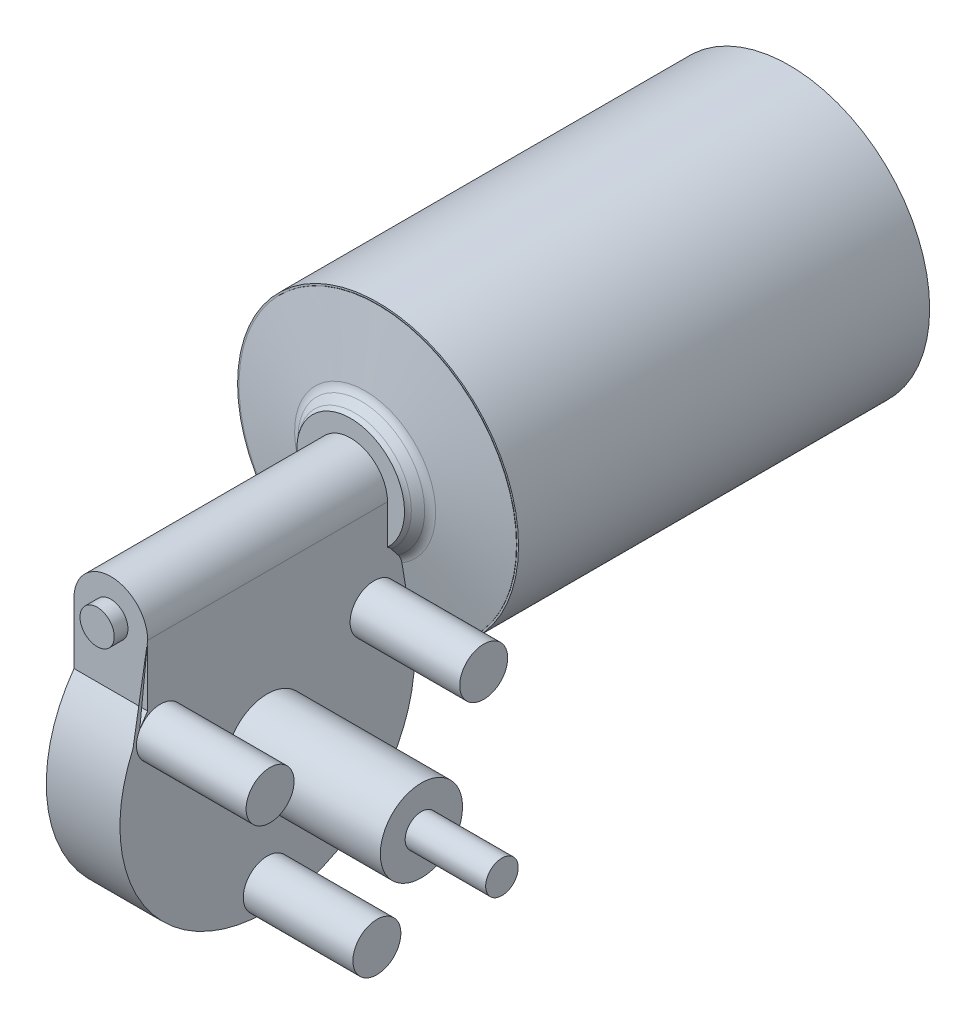
from build123d import *

# Parameters (mm, degrees)
SKETCH1_R           = 41
BOSS_EXTRUDE1_DEPTH = 62
SKETCH2_R           = 41
BOSS_EXTRUDE2_DEPTH = 4
SKETCH3_R           = 41
SKETCH3_R_2         = 40.5
CUT_EXTRUDE1_DEPTH  = 8
SKETCH5_R           = 10.75
BOSS_EXTRUDE3_DEPTH = 70
SKETCH6_R           = 5
BOSS_EXTRUDE4_DEPTH = 4
BOSS_EXTRUDE5_DEPTH = 10.75
SKETCH8_R           = 7
BOSS_EXTRUDE6_DEPTH = 32
SKETCH9_R           = 12
BOSS_EXTRUDE7_DEPTH = 45
SKETCH10_R          = 4.75
BOSS_EXTRUDE8_DEPTH = 23.5


with BuildPart() as part:
    # Sketch1 → Boss-Extrude1 (new, symmetric)
    with BuildSketch(Plane.XY):
        Circle(SKETCH1_R)
    extrude(amount=BOSS_EXTRUDE1_DEPTH, both=True)

    # Sketch2 → Boss-Extrude2 (add, symmetric)
    with BuildSketch(Plane.XY.offset(62)):
        Circle(SKETCH2_R)
    extrude(amount=BOSS_EXTRUDE2_DEPTH, both=True)

    # Sketch3 → Cut-Extrude1 (cut)
    with BuildSketch(Plane.XY.offset(66)):
        Circle(SKETCH3_R)
        Circle(SKETCH3_R_2, mode=Mode.SUBTRACT)
    extrude(amount=-CUT_EXTRUDE1_DEPTH, mode=Mode.SUBTRACT)

    # Sketch4 → Cut-Revolve1 (revolve, cut)
    with BuildSketch(Plane(origin=(0, 0, 0), x_dir=(0, 0, -1), z_dir=(1, 0, 0)), mode=Mode.PRIVATE) as cut_revolve1_sk:
        with BuildLine():
            Line((-58, 41), (-61.774006584, 20.588938621))
            ThreePointArc((-61.774006584, 20.588938621), (-62.166989532, 19.454504548), (-62.878908123, 18.487784224))
            Line((-62.878908123, 18.487784224), (-64.828427125, 16.538265222))
            ThreePointArc((-64.828427125, 16.538265222), (-66.12612052, 15.671174217), (-67.656854249, 15.366692347))
            Line((-67.656854249, 15.366692347), (-68, 15.366692347))
            Line((-68, 15.366692347), (-68, 44))
            Line((-68, 44), (-58, 44))
            Line((-58, 44), (-58, 41))
        make_face()
    revolve(cut_revolve1_sk.sketch.rotate(Axis((0, 0, 0), (0, 0, -1)), 90), axis=Axis((0, 0, 0), (0, 0, -1)), mode=Mode.SUBTRACT)

    # Sketch5 → Boss-Extrude3 (add)
    with BuildSketch(Plane.XY.offset(66)):
        Circle(SKETCH5_R)
    extrude(amount=BOSS_EXTRUDE3_DEPTH)

    # Sketch6 → Boss-Extrude4 (add, symmetric)
    with BuildSketch(Plane.XY.offset(136)):
        Circle(SKETCH6_R)
    extrude(amount=BOSS_EXTRUDE4_DEPTH, both=True)

    # Sketch7 → Boss-Extrude5 (add, symmetric)
    with BuildSketch(Plane(origin=(0, 0, 0), x_dir=(0, 0, -1), z_dir=(1, 0, 0))):
        with BuildLine():
            Line((-136, 0), (-136, -17.890978608))
            ThreePointArc((-136, -17.890978608), (-114.282888831, -83.926914424), (-58.092450033, -43))
            Line((-58.092450033, -43), (-58.092450033, 0))
            Line((-58.092450033, 0), (-136, 0))
        make_face()
    extrude(amount=BOSS_EXTRUDE5_DEPTH, both=True)

    # Sketch8 → Boss-Extrude6 (add)
    with BuildSketch(Plane(origin=(10.75, 0, 0), x_dir=(0, 0, -1), z_dir=(1, 0, 0))):
        with Locations((-69.915535496, -25)):
            Circle(SKETCH8_R)
        with Locations(Location((-101.092450033, -79, 0), (0, 0, 269.999665288))):
            Circle(SKETCH8_R)
        with Locations(Location((-132.269364569, -25, 0), (0, 0, 149.999665321))):
            Circle(SKETCH8_R)
    extrude(amount=BOSS_EXTRUDE6_DEPTH)

    # Sketch9 → Boss-Extrude7 (add)
    with BuildSketch(Plane(origin=(10.75, 0, 0), x_dir=(0, 0, -1), z_dir=(1, 0, 0))):
        with Locations(Location((-101.092450033, -43, 0), (0, 0, 180))):
            Circle(SKETCH9_R)
    extrude(amount=BOSS_EXTRUDE7_DEPTH)

    # Sketch10 → Boss-Extrude8 (add)
    with BuildSketch(Plane(origin=(55.75, 0, 0), x_dir=(0, 0, -1), z_dir=(1, 0, 0))):
        with Locations((-101.092450033, -43)):
            Circle(SKETCH10_R)
    extrude(amount=BOSS_EXTRUDE8_DEPTH)


solid = part.part
